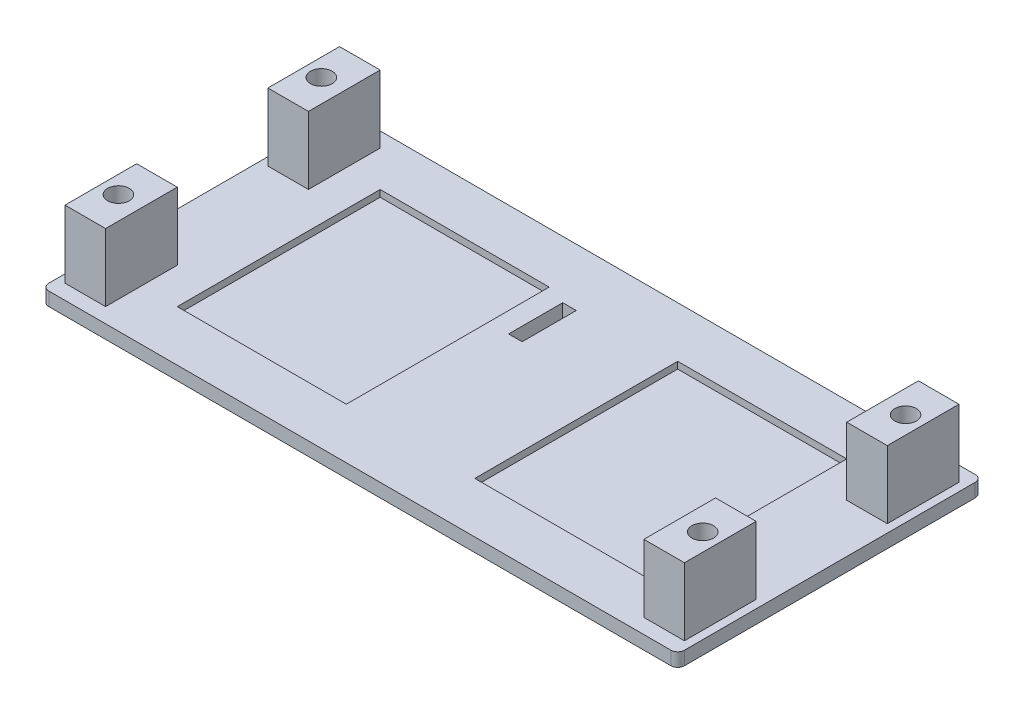
from build123d import *

# Parameters (mm, degrees)
SKETCH1_W                                           = 94
SKETCH1_H                                           = 45
BOSS_EXTRUDE1_DEPTH                                 = 2
FILLET1_R                                           = 1
SKETCH2_W                                           = 6
SKETCH2_H                                           = 10.6
BOSS_EXTRUDE2_DEPTH                                 = 10
SKETCH8_W                                           = 25
SKETCH8_H                                           = 30
CUT_EXTRUDE1_DEPTH                                  = 1
CSK_FOR_M5_COUNTERSUNK_FLAT_HEAD_SCREW1_D           = 3.2
CSK_FOR_M5_COUNTERSUNK_FLAT_HEAD_SCREW1_DEPTH       = 15
CSK_FOR_M5_COUNTERSUNK_FLAT_HEAD_SCREW1_CSINK_D     = 6
CSK_FOR_M5_COUNTERSUNK_FLAT_HEAD_SCREW1_CSINK_ANGLE = 90
CUT_EXTRUDE2_REACH                                  = 55.472
SKETCH9_W                                           = 2
SKETCH9_H                                           = 8


with BuildPart() as part:
    # Sketch1 → Boss-Extrude1 (new body)
    with BuildSketch(Plane(origin=(0, 0, 0), x_dir=(1, 0, 0), z_dir=(0, 1, 0))):
        Rectangle(SKETCH1_W, SKETCH1_H)
    extrude(amount=BOSS_EXTRUDE1_DEPTH)

    # Fillet1
    fillet1_edges = [part.edges().sort_by_distance(p)[0] for p in [
        (-47, 1, 22.5),
        (47, 1, 22.5),
        (47, 1, -22.5),
        (-47, 1, -22.5),
    ]]
    fillet(fillet1_edges, radius=FILLET1_R)

    # Sketch2 → Boss-Extrude2 (add)
    with BuildSketch(Plane(origin=(0, 2, 0), x_dir=(1, 0, 0), z_dir=(0, 1, 0))):
        with Locations((-42.8, -15)):
            Rectangle(SKETCH2_W, SKETCH2_H)
        with Locations((-42.8, 15)):
            Rectangle(SKETCH2_W, SKETCH2_H)
    boss_extrude2 = extrude(amount=BOSS_EXTRUDE2_DEPTH)

    # Sketch8 → Cut-Extrude1 (cut)
    with BuildSketch(Plane(origin=(0, 2, 0), x_dir=(1, 0, 0), z_dir=(0, 1, 0))):
        with Locations((-22, 0)):
            Rectangle(SKETCH8_W, SKETCH8_H)
    cut_extrude1 = extrude(amount=-CUT_EXTRUDE1_DEPTH, mode=Mode.SUBTRACT)

    # CSK for M5 Countersunk Flat Head Screw1
    with Locations(Plane(origin=(-43.2, 0, -15), x_dir=(0, 0, -1), z_dir=(0, -1, 0))):
        with Locations((0, 0), (-30, 0)):
            csk_for_m5_countersunk_flat_head_screw1 = CounterSinkHole(CSK_FOR_M5_COUNTERSUNK_FLAT_HEAD_SCREW1_D / 2, CSK_FOR_M5_COUNTERSUNK_FLAT_HEAD_SCREW1_CSINK_D / 2, depth=CSK_FOR_M5_COUNTERSUNK_FLAT_HEAD_SCREW1_DEPTH, counter_sink_angle=CSK_FOR_M5_COUNTERSUNK_FLAT_HEAD_SCREW1_CSINK_ANGLE)

    # Mirror1: Boss-Extrude2, Cut-Extrude1, CSK for M5 Countersunk Flat Head Screw1 across plane
    add(boss_extrude2.mirror(Plane.ZY))
    add(cut_extrude1.mirror(Plane.ZY), mode=Mode.SUBTRACT)
    add(csk_for_m5_countersunk_flat_head_screw1.mirror(Plane.ZY), mode=Mode.SUBTRACT)

    # Sketch9 → Cut-Extrude2 (cut, up to next)
    with BuildSketch(Plane.XZ, mode=Mode.PRIVATE) as cut_extrude2_sk1:
        with Locations((-5.5, -10)):
            Rectangle(SKETCH9_W, SKETCH9_H)
    cut_extrude2_tool1 = extrude(cut_extrude2_sk1.sketch, amount=-CUT_EXTRUDE2_REACH, mode=Mode.PRIVATE) & part.part
    add(cut_extrude2_tool1.solids().sort_by_distance((-5.5, 0, -10))[0], mode=Mode.SUBTRACT)


solid = part.part
